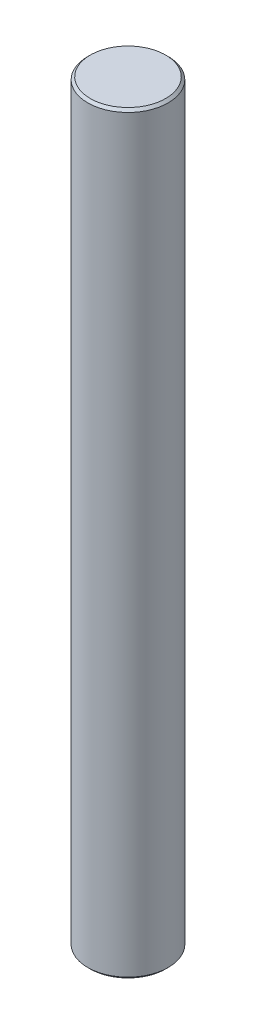
from build123d import *

# Parameters (mm, degrees)
SKETCH1_R           = 4
BOSS_EXTRUDE1_DEPTH = 75
CHAMFER1_SIZE       = 0.25


with BuildPart() as part:
    # Sketch1 → Boss-Extrude1 (new body)
    with BuildSketch(Plane(origin=(0, 0, 0), x_dir=(1, 0, 0), z_dir=(0, 1, 0))):
        with Locations(Location((0, 0, 0), (0, 0, 270))):
            Circle(SKETCH1_R)
    extrude(amount=BOSS_EXTRUDE1_DEPTH)

    # Chamfer1
    chamfer1_edges = [part.edges().sort_by_distance(p)[0] for p in [
        (0, 0, -4),
        (0, 75, -4),
    ]]
    chamfer(chamfer1_edges, length=CHAMFER1_SIZE)


solid = part.part
